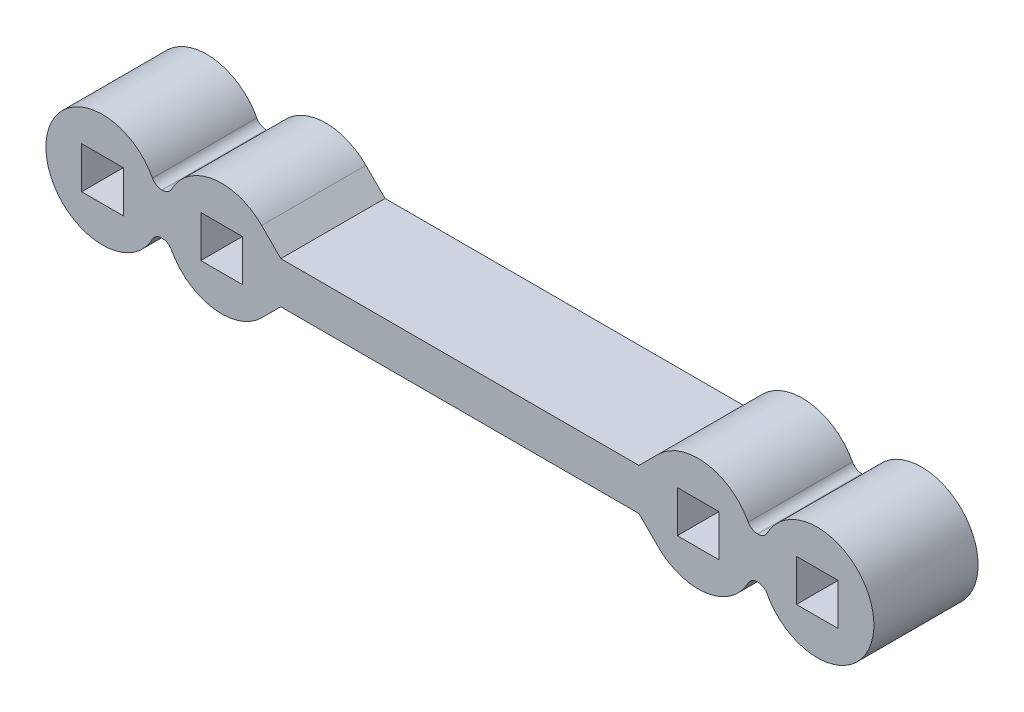
from build123d import *

# Parameters (mm, degrees)
ESBO_O1_W                = 2.8
ESBO_O1_H                = 2.8
RESSALTO_EXTRUS_O1_DEPTH = 7


with BuildPart() as part:
    # Esboço1 → Ressalto-extrusão1 (new body)
    with BuildSketch(Plane.XY):
        with BuildLine():
            Line((13.312994231, 2.687005769), (12.025988463, 1.4))
            Line((12.025988463, 1.4), (-12.025988463, 1.4))
            Line((-12.025988463, 1.4), (-13.312994231, 2.687005769))
            ThreePointArc((-13.312994231, 2.687005769), (-16.56763954, 3.75736415), (-19.360846454, 1.773333333))
            ThreePointArc((-19.360846454, 1.773333333), (-19.618471303, 1.500555813), (-19.979949748, 1.4))
            Line((-19.979949748, 1.4), (-20.020050252, 1.4))
            ThreePointArc((-20.020050252, 1.4), (-20.381528697, 1.500555813), (-20.639153546, 1.773333333))
            ThreePointArc((-20.639153546, 1.773333333), (-27.8, 0), (-20.639153546, -1.773333333))
            ThreePointArc((-20.639153546, -1.773333333), (-20.381528697, -1.500555813), (-20.020050252, -1.4))
            Line((-20.020050252, -1.4), (-19.979949748, -1.4))
            ThreePointArc((-19.979949748, -1.4), (-19.618471303, -1.500555813), (-19.360846454, -1.773333333))
            ThreePointArc((-19.360846454, -1.773333333), (-16.56763954, -3.75736415), (-13.312994231, -2.687005769))
            Line((-13.312994231, -2.687005769), (-12.025988463, -1.4))
            Line((-12.025988463, -1.4), (12.025988463, -1.4))
            Line((12.025988463, -1.4), (13.312994231, -2.687005769))
            ThreePointArc((13.312994231, -2.687005769), (16.56763954, -3.75736415), (19.360846454, -1.773333333))
            ThreePointArc((19.360846454, -1.773333333), (19.618471303, -1.500555813), (19.979949748, -1.4))
            Line((19.979949748, -1.4), (20.020050252, -1.4))
            ThreePointArc((20.020050252, -1.4), (20.381528697, -1.500555813), (20.639153546, -1.773333333))
            ThreePointArc((20.639153546, -1.773333333), (27.8, 0), (20.639153546, 1.773333333))
            ThreePointArc((20.639153546, 1.773333333), (20.381528697, 1.500555813), (20.020050252, 1.4))
            Line((20.020050252, 1.4), (19.979949748, 1.4))
            ThreePointArc((19.979949748, 1.4), (19.618471303, 1.500555813), (19.360846454, 1.773333333))
            ThreePointArc((19.360846454, 1.773333333), (16.56763954, 3.75736415), (13.312994231, 2.687005769))
        make_face()
        with Locations((16, 0)):
            Rectangle(ESBO_O1_W, ESBO_O1_H, mode=Mode.SUBTRACT)
        with Locations((24, 0)):
            Rectangle(ESBO_O1_W, ESBO_O1_H, mode=Mode.SUBTRACT)
        with Locations((-24, 0)):
            Rectangle(ESBO_O1_W, ESBO_O1_H, mode=Mode.SUBTRACT)
        with Locations((-16, 0)):
            Rectangle(ESBO_O1_W, ESBO_O1_H, mode=Mode.SUBTRACT)
    extrude(amount=RESSALTO_EXTRUS_O1_DEPTH)


solid = part.part
